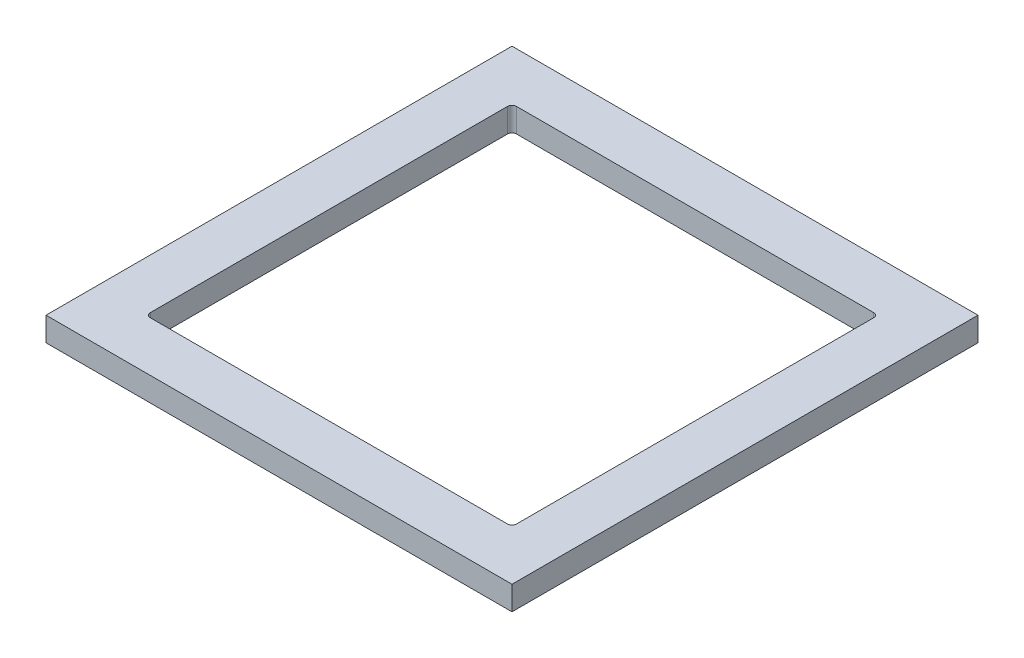
from build123d import *

# Parameters (mm, degrees)
SKETCH1_W           = 355.6
SKETCH1_H           = 355.6
BOSS_EXTRUDE1_DEPTH = 18.25625
SKETCH8_W           = 279.4
SKETCH8_H           = 279.4
CUT_EXTRUDE3_DEPTH  = 253.109045185
FILLET2_R           = 3.3782


with BuildPart() as part:
    # Sketch1 → Boss-Extrude1 (new body)
    with BuildSketch(Plane(origin=(0, 0, 0), x_dir=(1, 0, 0), z_dir=(0, 1, 0))):
        Rectangle(SKETCH1_W, SKETCH1_H)
    extrude(amount=BOSS_EXTRUDE1_DEPTH)

    # Sketch8 → Cut-Extrude3 (cut, through all)
    with BuildSketch(Plane(origin=(0, 18.25625, 0), x_dir=(1, 0, 0), z_dir=(0, 1, 0))):
        Rectangle(SKETCH8_W, SKETCH8_H)
    extrude(amount=-CUT_EXTRUDE3_DEPTH, mode=Mode.SUBTRACT)

    # Fillet2
    fillet2_edges = [part.edges().sort_by_distance(p)[0] for p in [
        (-139.7, 9.128125, 139.7),
        (-139.7, 9.128125, -139.7),
        (139.7, 9.128125, -139.7),
        (139.7, 9.128125, 139.7),
    ]]
    fillet(fillet2_edges, radius=FILLET2_R)


solid = part.part
